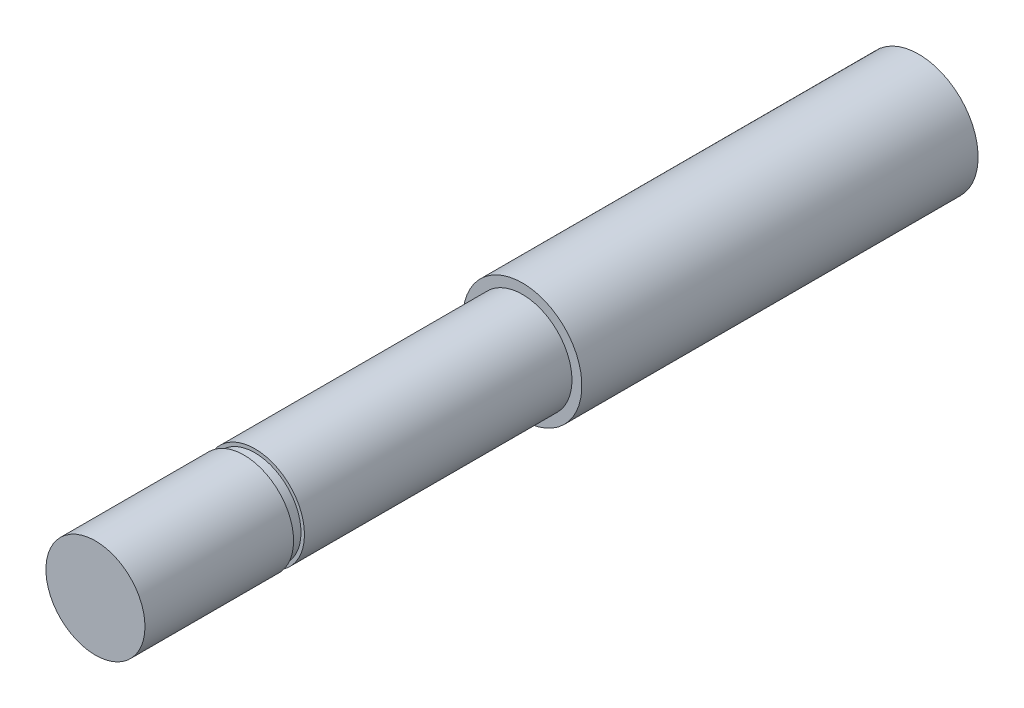
from build123d import *

# Parameters (mm, degrees)
SKETCH_1_R      = 5
EXTRUDE_1_DEPTH = 27
SKETCH_2_R      = 6
EXTRUDE_2_DEPTH = 40
SKETCH_3_R      = 4.65
EXTRUDE_3_DEPTH = 1.1
SKETCH_4_R      = 5
EXTRUDE_4_DEPTH = 15


with BuildPart() as part:
    # 草图1 → 凸台-拉伸1 (new body)
    with BuildSketch(Plane.XY):
        Circle(SKETCH_1_R)
    extrude(amount=EXTRUDE_1_DEPTH)

    # 草图2 → 凸台-拉伸2 (add)
    with BuildSketch(Plane(origin=(0, 0, 0), x_dir=(-1, 0, 0), z_dir=(0, 0, -1))):
        Circle(SKETCH_2_R)
    extrude(amount=EXTRUDE_2_DEPTH)

    # 草图3 → 凸台-拉伸3 (add)
    with BuildSketch(Plane.XY.offset(27)):
        Circle(SKETCH_3_R)
    extrude(amount=EXTRUDE_3_DEPTH)

    # 草图4 → 凸台-拉伸4 (add)
    with BuildSketch(Plane.XY.offset(28.1)):
        with Locations(Location((0, 0, 0), (0, 0, 180))):
            Circle(SKETCH_4_R)
    extrude(amount=EXTRUDE_4_DEPTH)


solid = part.part
